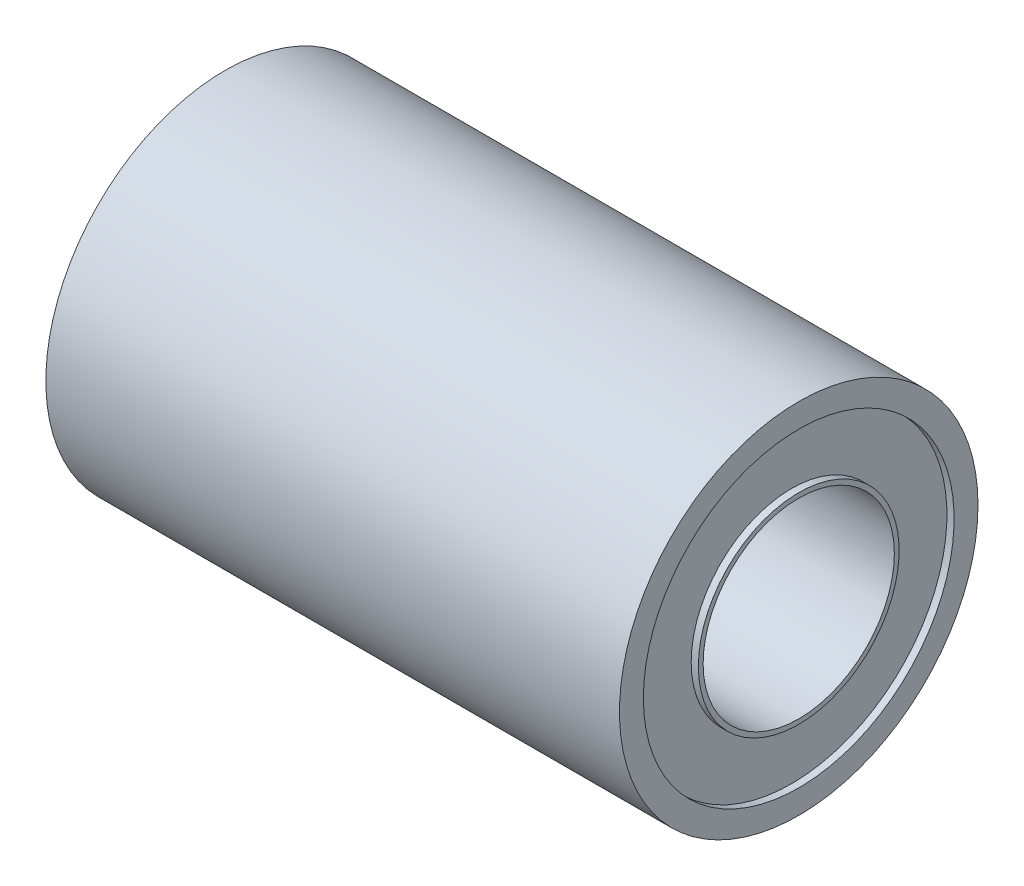
from build123d import *

# Parameters (mm, degrees)
SKETCH1_R           = 7.5
SKETCH1_R_2         = 4
BOSS_EXTRUDE1_DEPTH = 24
SKETCH2_W           = 0.3
SKETCH2_H           = 2.3


with BuildPart() as part:
    # Sketch1 → Boss-Extrude1 (new body)
    with BuildSketch(Plane(origin=(0, 0, 0), x_dir=(0, 0, -1), z_dir=(1, 0, 0))):
        Circle(SKETCH1_R)
        Circle(SKETCH1_R_2, mode=Mode.SUBTRACT)
    extrude(amount=BOSS_EXTRUDE1_DEPTH)

    # Sketch2 → Cut-Revolve1 (revolve, cut)
    with BuildSketch(Plane.XY, mode=Mode.PRIVATE) as cut_revolve1_sk:
        with Locations((23.85, 5.35)):
            Rectangle(SKETCH2_W, SKETCH2_H)
        with Locations((0.15, 5.35)):
            Rectangle(SKETCH2_W, SKETCH2_H)
    revolve(cut_revolve1_sk.sketch.rotate(Axis((0, 0, 0), (1, 0, 0)), 90), axis=Axis((0, 0, 0), (1, 0, 0)), mode=Mode.SUBTRACT)


solid = part.part
